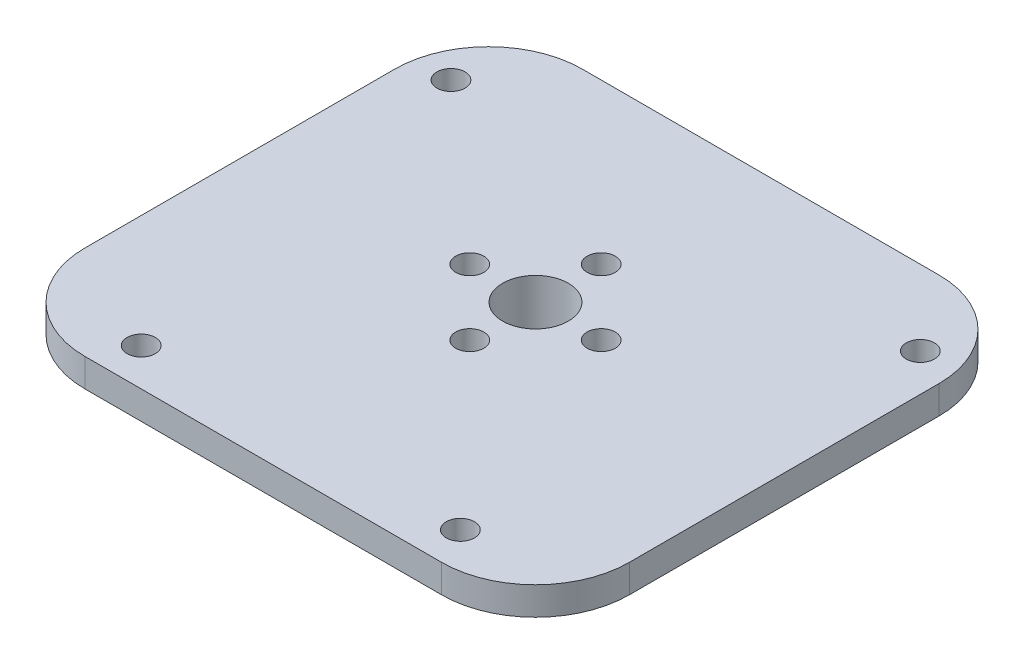
from build123d import *
from build123d.topology import SkipClean

# Parameters (mm, degrees)
SKETCH_1_W          = 58
SKETCH_1_H          = 58
SKETCH_1_R          = 1.5
SKETCH_1_R_2        = 3.5
EXTRUDE_1_DEPTH     = 3
EXTRUDE_START       = 5
SKETCH_2_R          = 12.5
SKETCH_2_R_2        = 1.5
SKETCH_2_R_3        = 3.5
EXTRUDE_2_DEPTH     = 5
EXTRUDE_START_2     = 7
SKETCH_6_R          = 17
SKETCH_6_R_2        = 12.5
EXTRUDE_3_DEPTH     = 7
SKETCH_8_R          = 26
SKETCH_8_R_2        = 12
EXTRUDE_5_DEPTH     = 2
SKETCH_10_W         = 58
SKETCH_10_H         = 5
CUT_EXTRUDE_1_DEPTH = 10
FILLET_1_R          = 10


with BuildPart() as part:
    # 草图1 → 凸台-拉伸1 (new body)
    with BuildSketch(Plane(origin=(0, 0, 0), x_dir=(1, 0, 0), z_dir=(0, 1, 0))):
        Rectangle(SKETCH_1_W, SKETCH_1_H)
        with Locations(Location((0, 7, 0), (0, 0, 270))):
            Circle(SKETCH_1_R, mode=Mode.SUBTRACT)
        with Locations(Location((7, 0, 0), (0, 0, 270))):
            Circle(SKETCH_1_R, mode=Mode.SUBTRACT)
        with Locations(Location((0, 0, 0), (0, 0, 270))):
            Circle(SKETCH_1_R_2, mode=Mode.SUBTRACT)
        with Locations(Location((0, -7, 0), (0, 0, 90))):
            Circle(SKETCH_1_R, mode=Mode.SUBTRACT)
        with Locations(Location((-7, 0, 0), (0, 0, 90))):
            Circle(SKETCH_1_R, mode=Mode.SUBTRACT)
        with Locations(Location((25, 16, 0), (0, 0, 270))):
            Circle(SKETCH_1_R, mode=Mode.SUBTRACT)
        with Locations(Location((-25, 16, 0), (0, 0, 90))):
            Circle(SKETCH_1_R, mode=Mode.SUBTRACT)
        with Locations(Location((17, -25, 0), (0, 0, 270))):
            Circle(SKETCH_1_R, mode=Mode.SUBTRACT)
        with Locations(Location((-17, -25, 0), (0, 0, 90))):
            Circle(SKETCH_1_R, mode=Mode.SUBTRACT)
    extrude(amount=EXTRUDE_1_DEPTH)

    # 草图2 → 凸台-拉伸2 (add)
    with SkipClean():  # the faces are left unmerged after this step: merging them gives an invalid solid
        with BuildSketch(Plane.XZ.offset(EXTRUDE_START)):
            with Locations(Location((0, 0, 0), (0, 0, 270))):
                Circle(SKETCH_2_R)
            with Locations(Location((0, 7, 0), (0, 0, 270))):
                Circle(SKETCH_2_R_2, mode=Mode.SUBTRACT)
            with Locations(Location((0, 0, 0), (0, 0, 270))):
                Circle(SKETCH_2_R_3, mode=Mode.SUBTRACT)
            with Locations(Location((-7, 0, 0), (0, 0, 270))):
                Circle(SKETCH_2_R_2, mode=Mode.SUBTRACT)
            with Locations(Location((0, -7, 0), (0, 0, 270))):
                Circle(SKETCH_2_R_2, mode=Mode.SUBTRACT)
            with Locations(Location((7, 0, 0), (0, 0, 270))):
                Circle(SKETCH_2_R_2, mode=Mode.SUBTRACT)
        extrude(amount=-EXTRUDE_2_DEPTH)

    # 草图6 → 凸台-拉伸3 (add)
    with SkipClean():  # the faces are left unmerged after this step: merging them gives an invalid solid
        with BuildSketch(Plane.XZ.offset(EXTRUDE_START_2)):
            with Locations(Location((0, 0, 0), (0, 0, 270))):
                Circle(SKETCH_6_R)
            with Locations(Location((0, 0, 0), (0, 0, 270))):
                Circle(SKETCH_6_R_2, mode=Mode.SUBTRACT)
        extrude(amount=-EXTRUDE_3_DEPTH)

    # 草图8 → 凸台-拉伸5 (add)
    with SkipClean():  # the faces are left unmerged after this step: merging them gives an invalid solid
        with BuildSketch(Plane.XZ):
            with Locations(Location((0, 0, 0), (0, 0, 270))):
                Circle(SKETCH_8_R)
            Circle(SKETCH_8_R_2, mode=Mode.SUBTRACT)
        extrude(amount=EXTRUDE_5_DEPTH)

    # 草图10 → 切除-拉伸1 (cut)
    with BuildSketch(Plane(origin=(0, 3, 0), x_dir=(1, 0, 0), z_dir=(0, 1, 0))):
        with Locations((0, 26.5)):
            Rectangle(SKETCH_10_W, SKETCH_10_H)
    extrude(amount=-CUT_EXTRUDE_1_DEPTH, mode=Mode.SUBTRACT)

    # 圆角1
    fillet_1_edges = [part.edges().sort_by_distance(p)[0] for p in [
        (29, 1.5, 29),
        (-29, 1.5, 29),
        (29, 1.5, -24),
        (-29, 1.5, -24),
    ]]
    fillet(fillet_1_edges, radius=FILLET_1_R)


solid = part.part
